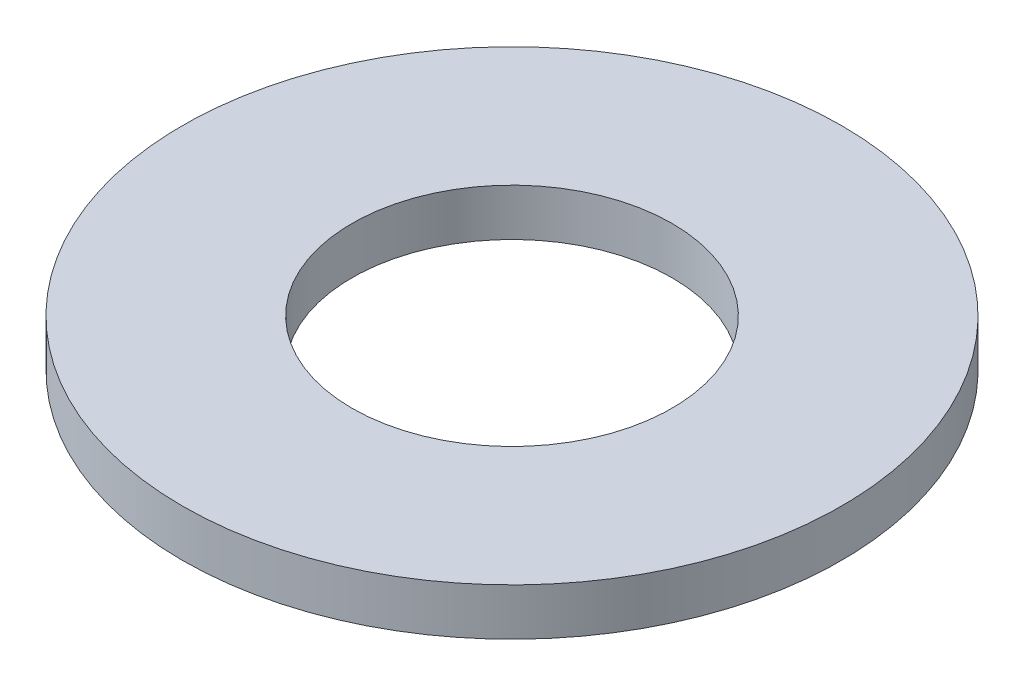
from build123d import *

# Parameters (mm, degrees)
BASE_OUTLINE_SKETCH_R   = 3.5
BASE_OUTLINE_SKETCH_R_2 = 1.7
BASE_OUTLINE_DEPTH      = 0.5


with BuildPart() as part:
    # Base Outline Sketch → Base Outline (new body)
    with BuildSketch(Plane(origin=(0, 157, 0), x_dir=(1, 0, 0), z_dir=(0, 1, 0))):
        with Locations(Location((-56.291651246, -50, 0), (0, 0, 270))):
            Circle(BASE_OUTLINE_SKETCH_R)
        with Locations(Location((-56.291651246, -50, 0), (0, 0, 270))):
            Circle(BASE_OUTLINE_SKETCH_R_2, mode=Mode.SUBTRACT)
    extrude(amount=BASE_OUTLINE_DEPTH)


solid = part.part
